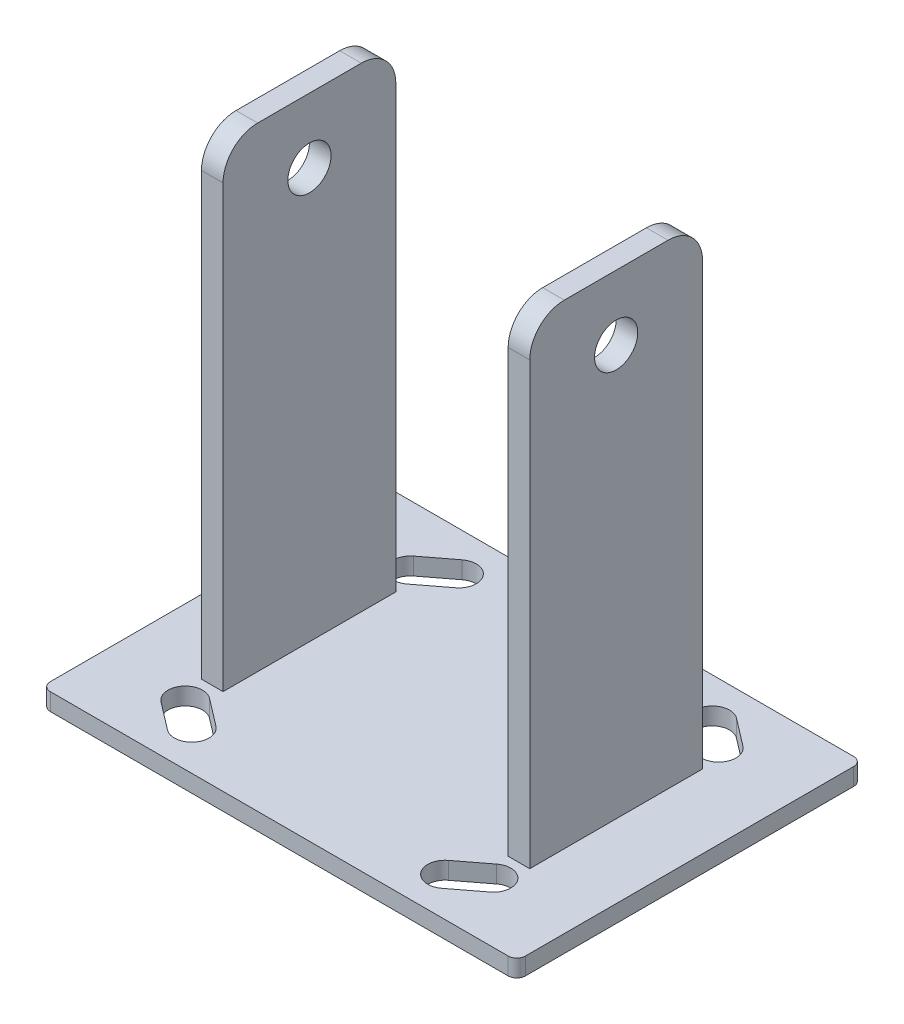
from build123d import *

# Parameters (mm, degrees)
SKETCH1_W           = 139.7
SKETCH1_H           = 101.6
BOSS_EXTRUDE1_DEPTH = 5.08
FILLET1_R           = 2.54
SKETCH2_W           = 6.35
SKETCH2_H           = 50.8
BOSS_EXTRUDE2_DEPTH = 139.7
FILLET2_R           = 10.16
SKETCH3_R           = 6.35
CUT_EXTRUDE1_DEPTH  = 194.628150071


with BuildPart() as part:
    # Sketch1 → Boss-Extrude1 (new body)
    with BuildSketch(Plane(origin=(0, 0, 0), x_dir=(1, 0, 0), z_dir=(0, 1, 0))):
        Rectangle(SKETCH1_W, SKETCH1_H)
        with BuildLine():
            ThreePointArc((-40.325508755, -43.316184338), (-33.204324417, -42.366693093), (-34.153815662, -35.245508755))
            Line((-34.153815662, -35.245508755), (-42.224491245, -29.073815662))
            ThreePointArc((-42.224491245, -29.073815662), (-49.345675583, -30.023306907), (-48.396184338, -37.144491245))
            Line((-48.396184338, -37.144491245), (-40.325508755, -43.316184338))
        make_face(mode=Mode.SUBTRACT)
        with BuildLine():
            ThreePointArc((-48.396184338, 37.144491245), (-49.345675583, 30.023306907), (-42.224491245, 29.073815662))
            Line((-42.224491245, 29.073815662), (-34.153815662, 35.245508755))
            ThreePointArc((-34.153815662, 35.245508755), (-33.204324417, 42.366693093), (-40.325508755, 43.316184338))
            Line((-40.325508755, 43.316184338), (-48.396184338, 37.144491245))
        make_face(mode=Mode.SUBTRACT)
        with BuildLine():
            ThreePointArc((40.325508755, 43.316184338), (33.204324417, 42.366693093), (34.153815662, 35.245508755))
            Line((34.153815662, 35.245508755), (42.224491245, 29.073815662))
            ThreePointArc((42.224491245, 29.073815662), (49.345675583, 30.023306907), (48.396184338, 37.144491245))
            Line((48.396184338, 37.144491245), (40.325508755, 43.316184338))
        make_face(mode=Mode.SUBTRACT)
        with BuildLine():
            Line((48.396184338, -37.144491245), (40.325508755, -43.316184338))
            ThreePointArc((40.325508755, -43.316184338), (33.204324417, -42.366693093), (34.153815662, -35.245508755))
            Line((34.153815662, -35.245508755), (42.224491245, -29.073815662))
            ThreePointArc((42.224491245, -29.073815662), (49.345675583, -30.023306907), (48.396184338, -37.144491245))
        make_face(mode=Mode.SUBTRACT)
    extrude(amount=BOSS_EXTRUDE1_DEPTH)

    # Fillet1
    fillet1_edges = [part.edges().sort_by_distance(p)[0] for p in [
        (69.85, 2.54, -50.8),
        (69.85, 2.54, 50.8),
        (-69.85, 2.54, 50.8),
        (-69.85, 2.54, -50.8),
    ]]
    fillet(fillet1_edges, radius=FILLET1_R)

    # Sketch2 → Boss-Extrude2 (add)
    with BuildSketch(Plane(origin=(0, 5.08, 0), x_dir=(1, 0, 0), z_dir=(0, 1, 0))):
        with Locations((45.085, 0)):
            Rectangle(SKETCH2_W, SKETCH2_H)
        with Locations((-45.085, 0)):
            Rectangle(SKETCH2_W, SKETCH2_H)
    extrude(amount=BOSS_EXTRUDE2_DEPTH)

    # Fillet2
    fillet2_edges = [part.edges().sort_by_distance(p)[0] for p in [
        (-45.085, 144.78, -25.4),
        (-45.085, 144.78, 25.4),
        (45.085, 144.78, -25.4),
        (45.085, 144.78, 25.4),
    ]]
    fillet(fillet2_edges, radius=FILLET2_R)

    # Sketch3 → Cut-Extrude1 (cut, through all)
    with BuildSketch(Plane.ZY.offset(48.26)):
        with Locations((0, 125.73)):
            Circle(SKETCH3_R)
    extrude(amount=-CUT_EXTRUDE1_DEPTH, mode=Mode.SUBTRACT)


solid = part.part
